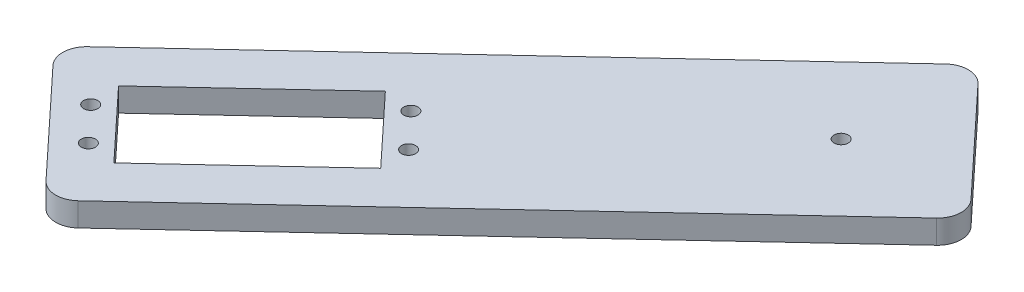
from build123d import *

# Parameters (mm, degrees)
SKETCH_1_R      = 1.5
EXTRUDE_1_DEPTH = 5


with BuildPart() as part:
    # 草图1 → 凸台-拉伸1 (new body)
    with BuildSketch(Plane(origin=(0, 0, 0), x_dir=(1, 0, 0), z_dir=(0, 1, 0))):
        with BuildLine():
            Line((-20.911015375, -19.880881436), (-115.012388245, -107.631831263))
            ThreePointArc((-115.012388245, -107.631831263), (-116.599350579, -111.114102288), (-115.259164952, -114.698591572))
            Line((-115.259164952, -114.698591572), (-94.79921415, -136.63920262))
            ThreePointArc((-94.79921415, -136.63920262), (-91.316943126, -138.226164955), (-87.732453842, -136.885979328))
            Line((-87.732453842, -136.885979328), (6.368919028, -49.135029501))
            ThreePointArc((6.368919028, -49.135029501), (7.955881363, -45.652758476), (6.615695736, -42.068269192))
            Line((6.615695736, -42.068269192), (-13.844255066, -20.127658144))
            ThreePointArc((-13.844255066, -20.127658144), (-17.326526091, -18.540695809), (-20.911015375, -19.880881436))
        make_face()
        with Locations(Location((-97.231075541, -125.233675444, 0), (0, 0, 270))):
            Circle(SKETCH_1_R, mode=Mode.SUBTRACT)
        with Locations(Location((-104.051059142, -117.920138427, 0), (0, 0, 270))):
            Circle(SKETCH_1_R, mode=Mode.SUBTRACT)
        with Locations(Location((-62.126097864, -92.497754161, 0), (0, 0, 270))):
            Circle(SKETCH_1_R, mode=Mode.SUBTRACT)
        with Locations(Location((-68.946081464, -85.184217144, 0), (0, 0, 270))):
            Circle(SKETCH_1_R, mode=Mode.SUBTRACT)
        with Locations(Location((-18.241353698, -44.737930869, 0), (0, 0, 90))):
            Circle(SKETCH_1_R, mode=Mode.SUBTRACT)
        Polygon((-90.895668935, -126.162450512), (-61.64152087, -98.882516109), (-75.281488071, -84.255442077), (-104.535636136, -111.535376479), align=None, mode=Mode.SUBTRACT)
    extrude(amount=EXTRUDE_1_DEPTH)


solid = part.part
